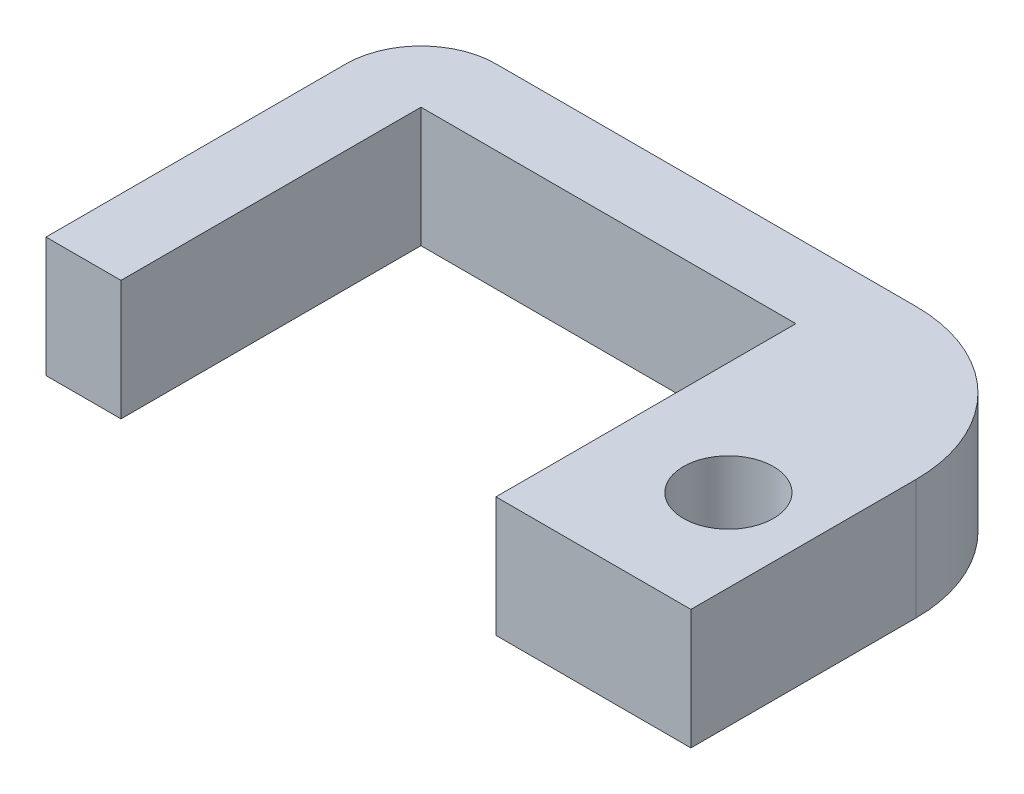
from build123d import *

# Parameters (mm, degrees)
CROQUIS1_R              = 2
SALIENTE_EXTRUIR1_DEPTH = 8
CROQUIS2_R              = 3
CORTAR_EXTRUIR1_DEPTH   = 9


with BuildPart() as part:
    # Croquis1 → Saliente-Extruir1 (new body)
    with BuildSketch(Plane(origin=(0, 0, 0), x_dir=(1, 0, 0), z_dir=(0, 1, 0))):
        with BuildLine():
            Line((25, 0), (38, 0))
            Line((38, 0), (38, 15))
            ThreePointArc((38, 15), (35.071067812, 22.071067812), (28, 25))
            Line((28, 25), (0, 25))
            ThreePointArc((0, 25), (-3.535533906, 23.535533906), (-5, 20))
            Line((-5, 20), (-5, 0))
            Line((-5, 0), (0, 0))
            Line((0, 0), (0, 20))
            Line((0, 20), (25, 20))
            Line((25, 20), (25, 0))
        make_face()
        with Locations(Location((32.5, 8, 0), (0, 0, 270))):
            Circle(CROQUIS1_R, mode=Mode.SUBTRACT)
    extrude(amount=SALIENTE_EXTRUIR1_DEPTH)

    # Croquis2 → Cortar-Extruir1 (cut)
    with BuildSketch(Plane.XZ):
        with Locations(Location((32.5, -8, 0), (0, 0, 270))):
            Circle(CROQUIS2_R)
    extrude(amount=-CORTAR_EXTRUIR1_DEPTH, mode=Mode.SUBTRACT)


solid = part.part
